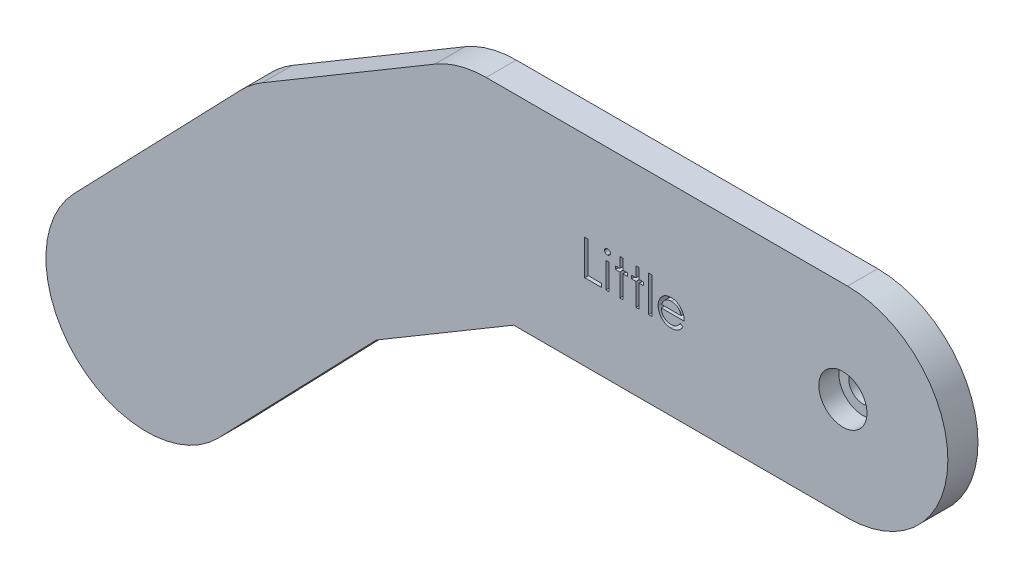
from build123d import *

# Parameters (mm, degrees)
BOSS_EXTRUDE1_DEPTH = 3
BOSS_EXTRUDE2_DEPTH = 3
BOSS_EXTRUDE4_DEPTH = 3
SKETCH4_R           = 1.4
CUT_EXTRUDE5_DEPTH  = 3
SKETCH5_R           = 2.4
CUT_EXTRUDE6_DEPTH  = 2
SKETCH6_W           = 0.314102564
SKETCH6_H           = 2.557692308
SKETCH6_W_2         = 0.314102565
SKETCH6_H_2         = 3.58974359
CUT_EXTRUDE7_DEPTH  = 1


with BuildPart() as part:
    # Sketch1 → Boss-Extrude1 (new body)
    with BuildSketch(Plane.XY):
        with BuildLine():
            Line((0, 10), (36, 10))
            ThreePointArc((36, 10), (46, 0), (36, -10))
            Line((36, -10), (0, -10))
            ThreePointArc((0, -10), (-10, 0), (0, 10))
        make_face()
    extrude(amount=BOSS_EXTRUDE1_DEPTH)

    # Sketch2 → Boss-Extrude2 (add)
    with BuildSketch(Plane.XY):
        with BuildLine():
            Line((5.104260767, -8.599216361), (-12.094171954, -18.807737895))
            ThreePointArc((-12.094171954, -18.807737895), (-25.797649082, -15.312782302), (-22.302693489, -1.609305174))
            Line((-22.302693489, -1.609305174), (-5.104260767, 8.599216361))
            ThreePointArc((-5.104260767, 8.599216361), (8.599216361, 5.104260767), (5.104260767, -8.599216361))
        make_face()
    extrude(amount=BOSS_EXTRUDE2_DEPTH)

    # Sketch3 → Boss-Extrude4 (add)
    with BuildSketch(Plane.XY):
        with BuildLine():
            Line((-9.998884105, -17.148730445), (-26.65538549, -34.427647124))
            ThreePointArc((-26.65538549, -34.427647124), (-40.795143017, -34.68698683), (-41.054482723, -20.547229303))
            Line((-41.054482723, -20.547229303), (-24.397981338, -3.268312624))
            ThreePointArc((-24.397981338, -3.268312624), (-10.258223811, -3.008972918), (-9.998884105, -17.148730445))
        make_face()
    extrude(amount=BOSS_EXTRUDE4_DEPTH)

    # Sketch4 → Cut-Extrude5 (cut)
    with BuildSketch(Plane.XY):
        with Locations((35.538598823, 0)):
            Circle(SKETCH4_R)
    extrude(amount=CUT_EXTRUDE5_DEPTH, mode=Mode.SUBTRACT)

    # Sketch5 → Cut-Extrude6 (cut)
    with BuildSketch(Plane.XY.offset(3)):
        with Locations((35.538598823, 0)):
            Circle(SKETCH5_R)
    extrude(amount=-CUT_EXTRUDE6_DEPTH, mode=Mode.SUBTRACT)

    # Sketch6 → Cut-Extrude7 (cut)
    # profile 1 of 7: a face of its own
    with BuildSketch(Plane.XY.offset(3)):
        Polygon((9.822398538, 1.128373328), (10.136501102, 1.128373328), (10.136501102, -2.012652313), (11.482654948, -2.012652313), (11.482654948, -2.371626672), (9.822398538, -2.371626672), align=None)
    # profile 2 of 7: a face of its own
    with BuildSketch(Plane.XY.offset(3)):
        with BuildLine():
            add(Edge.make_bspline(
                [(12.087021935, 1.262988713), (12.106513251, 1.26208456), (12.144680991, 1.260314056), (12.199874258, 1.245152579), (12.250131271, 1.219452894), (12.294709003, 1.184973213), (12.33296089, 1.144423769), (12.3597416, 1.097162801), (12.376953997, 1.046104162), (12.379032552, 1.010489073), (12.380090845, 0.9923557)],
                knots=[0, 0, 0, 0, 1.055194115, 2.066272739, 3.074728998, 4.095836921, 5.109056067, 6.073838105, 7.019297344, 8, 8, 8, 8], degree=3))
            add(Edge.make_bspline(
                [(12.380090845, 0.9923557), (12.379008686, 0.974693047), (12.376869384, 0.939776072), (12.359754895, 0.889602599), (12.332732658, 0.842998316), (12.294733532, 0.802527606), (12.250124771, 0.768066986), (12.199875985, 0.742362247), (12.144680537, 0.72720211), (12.106513097, 0.725431421), (12.087021935, 0.724527174)],
                knots=[0, 0, 0, 0, 0.96129708, 1.900370562, 2.859976407, 3.87933698, 4.906634145, 5.921202961, 6.938410037, 8, 8, 8, 8], degree=3))
            add(Edge.make_bspline(
                [(12.087021935, 0.724527174), (12.06775366, 0.725396894), (12.03025048, 0.727089691), (11.975883637, 0.742659709), (11.926055148, 0.768075782), (11.881390475, 0.802301967), (11.844160282, 0.843246864), (11.817061957, 0.889574158), (11.799986995, 0.939783313), (11.797842366, 0.974695479), (11.796757512, 0.9923557)],
                knots=[0, 0, 0, 0, 1.054934014, 2.053291228, 3.073705704, 4.106921865, 5.123545215, 6.088680038, 7.033164197, 8, 8, 8, 8], degree=3))
            add(Edge.make_bspline(
                [(11.796757512, 0.9923557), (11.797818599, 1.010486549), (11.79990264, 1.046096682), (11.817074756, 1.097191715), (11.843934564, 1.144173217), (11.881415127, 1.185198716), (11.926048587, 1.219444151), (11.975885333, 1.244855132), (12.030250032, 1.260426472), (12.067753508, 1.262119086), (12.087021935, 1.262988713)],
                knots=[0, 0, 0, 0, 0.98631895, 1.937192651, 2.907499808, 3.917963147, 4.944918757, 5.95915025, 6.951458133, 8, 8, 8, 8], degree=3))
        make_face()
    # profile 3 of 7: a face of its own
    with BuildSketch(Plane.XY.offset(3)):
        with Locations((12.088424179, -1.092780518)):
            Rectangle(SKETCH6_W, SKETCH6_H)
    # profile 4 of 7: a face of its own
    with BuildSketch(Plane.XY.offset(3)):
        Polygon((13.322398538, 1.218116918), (13.636501102, 1.218116918), (13.636501102, 0.186065636), (14.085219051, 0.186065636), (14.085219051, -0.128036928), (13.636501102, -0.128036928), (13.636501102, -2.371626672), (13.322398538, -2.371626672), (13.322398538, -0.128036928), (12.873680589, -0.128036928), (12.873680589, 0.186065636), (13.322398538, 0.186065636), align=None)
    # profile 5 of 7: a face of its own
    with BuildSketch(Plane.XY.offset(3)):
        Polygon((14.937783153, 1.218116918), (15.251885717, 1.218116918), (15.251885717, 0.186065636), (15.700603666, 0.186065636), (15.700603666, -0.128036928), (15.251885717, -0.128036928), (15.251885717, -2.371626672), (14.937783153, -2.371626672), (14.937783153, -0.128036928), (14.489065204, -0.128036928), (14.489065204, 0.186065636), (14.937783153, 0.186065636), align=None)
    # profile 6 of 7: a face of its own
    with BuildSketch(Plane.XY.offset(3)):
        with Locations((16.351244691, -0.576754877)):
            Rectangle(SKETCH6_W_2, SKETCH6_H_2)
    # profile 7 of 7: a face of its own
    with BuildSketch(Plane.XY.offset(3)):
        with BuildLine():
            Line((19.325403345, -1.563934364), (19.60444982, -1.71046882))
            add(Edge.make_bspline(
                [(19.60444982, -1.71046882), (19.582213225, -1.749912151), (19.538949616, -1.826653254), (19.464548868, -1.932085114), (19.386556796, -2.02693283), (19.301452828, -2.108662484), (19.211783149, -2.179913869), (19.117050494, -2.242251694), (19.016761676, -2.295370214), (18.910911951, -2.340122742), (18.7986124, -2.374532236), (18.679590884, -2.398836457), (18.553619388, -2.413859726), (18.467273209, -2.415604867), (18.423059595, -2.416498467)],
                knots=[0, 0, 0, 0, 1.120438281, 2.179929193, 3.190490725, 4.156257408, 5.095198341, 6.022838206, 6.959905092, 7.901321166, 8.864066838, 9.862729781, 10.905609505, 12, 12, 12, 12], degree=3))
            add(Edge.make_bspline(
                [(18.423059595, -2.416498467), (18.373917618, -2.415351292), (18.278055856, -2.413113485), (18.138516109, -2.39382102), (18.007136691, -2.362348662), (17.883924987, -2.31838312), (17.769182735, -2.260955796), (17.66268188, -2.190996314), (17.563862354, -2.10886406), (17.475838145, -2.013847616), (17.396594262, -1.912165659), (17.326668442, -1.806209774), (17.268211011, -1.69624655), (17.220658401, -1.582976026), (17.182253536, -1.467112132), (17.155486832, -1.347600665), (17.140057084, -1.224765081), (17.137692639, -1.141667745), (17.136501102, -1.099791736)],
                knots=[0, 0, 0, 0, 1.145258523, 2.234067595, 3.276747158, 4.290159414, 5.277019952, 6.260822364, 7.254936242, 8.264827045, 9.274100331, 10.257902744, 11.220704747, 12.172965371, 13.118907548, 14.062713208, 15.023725156, 16, 16, 16, 16], degree=3))
            add(Edge.make_bspline(
                [(17.136501102, -1.099791736), (17.137560243, -1.060496906), (17.139659321, -0.982619741), (17.152890109, -0.867354197), (17.176338402, -0.755325744), (17.208514726, -0.646441296), (17.250065972, -0.540883162), (17.300898191, -0.438587098), (17.361090569, -0.339661959), (17.407563243, -0.277258825), (17.430972256, -0.24582539)],
                knots=[0, 0, 0, 0, 1.024358464, 2.0301432, 3.019427413, 4.004406732, 4.986367066, 5.972626655, 6.978780325, 8, 8, 8, 8], degree=3))
            add(Edge.make_bspline(
                [(17.430972256, -0.24582539), (17.462679938, -0.20795652), (17.525090885, -0.133418369), (17.63064724, -0.035480044), (17.744947437, 0.046563731), (17.866559063, 0.114570868), (17.996895537, 0.166244515), (18.134204828, 0.204752097), (18.280050414, 0.226330108), (18.379755635, 0.229377941), (18.430771935, 0.23093743)],
                knots=[0, 0, 0, 0, 1.030682036, 2.02871468, 2.997146059, 3.962720338, 4.930598197, 5.918074684, 6.934738563, 8, 8, 8, 8], degree=3))
            add(Edge.make_bspline(
                [(18.430771935, 0.23093743), (18.48321954, 0.229583382), (18.586109786, 0.226927046), (18.736141907, 0.202300713), (18.878102624, 0.163248158), (19.011935128, 0.108094368), (19.137652989, 0.036934816), (19.254439039, -0.051207025), (19.364290551, -0.153625113), (19.42819913, -0.232388322), (19.460719852, -0.272468018)],
                knots=[0, 0, 0, 0, 1.056321875, 2.072262726, 3.055038591, 4.01806755, 4.982017516, 5.957941055, 6.960871419, 8, 8, 8, 8], degree=3))
            add(Edge.make_bspline(
                [(19.460719852, -0.272468018), (19.48284679, -0.3026716), (19.526953383, -0.362877718), (19.582200483, -0.461048875), (19.630157878, -0.56375947), (19.668490839, -0.672669767), (19.69953034, -0.786489347), (19.721987159, -0.906031892), (19.735156778, -1.031261803), (19.737745475, -1.116588359), (19.739065204, -1.160088211)],
                knots=[0, 0, 0, 0, 0.94817472, 1.890038105, 2.849395472, 3.817997239, 4.812318967, 5.836947057, 6.897266129, 8, 8, 8, 8], degree=3))
            Line((19.739065204, -1.160088211), (17.450603666, -1.160088211))
            add(Edge.make_bspline(
                [(17.450603666, -1.160088211), (17.452143272, -1.193788675), (17.455170846, -1.260059279), (17.469285989, -1.357030062), (17.491534763, -1.449403404), (17.522803826, -1.536486446), (17.560670671, -1.619416573), (17.607056388, -1.69757861), (17.662395942, -1.77061654), (17.724121641, -1.839183678), (17.792828737, -1.900244439), (17.865111484, -1.954896215), (17.942005049, -2.000701812), (18.022903132, -2.037881702), (18.107674917, -2.066988018), (18.196347113, -2.086855839), (18.288745229, -2.100162945), (18.351730963, -2.101642611), (18.383796775, -2.102395903)],
                knots=[0, 0, 0, 0, 1.094153842, 2.151609401, 3.174256925, 4.172055639, 5.149267565, 6.128595816, 7.11444997, 8.118368179, 9.117203808, 10.09244225, 11.054858984, 12.015122123, 12.976791628, 13.957293641, 14.960065497, 16, 16, 16, 16], degree=3))
            add(Edge.make_bspline(
                [(18.383796775, -2.102395903), (18.415147922, -2.101787846), (18.477354613, -2.100581345), (18.569995471, -2.088849434), (18.661134998, -2.069879159), (18.750395981, -2.043989169), (18.835966827, -2.012412316), (18.915212377, -1.974309459), (18.988092593, -1.932159712), (19.05620956, -1.883950037), (19.122280553, -1.82494185), (19.187823039, -1.751306129), (19.258099693, -1.664218601), (19.302089285, -1.598672935), (19.325403345, -1.563934364)],
                knots=[0, 0, 0, 0, 0.99110716, 1.966546729, 2.947904876, 3.932708344, 4.903319531, 5.828989031, 6.710028674, 7.56322171, 8.463672341, 9.504779593, 10.677557249, 12, 12, 12, 12], degree=3))
        make_face()
        with BuildLine():
            add(Edge.make_bspline(
                [(19.42496264, -0.845985646), (19.413466016, -0.804322773), (19.391338714, -0.724135152), (19.34510235, -0.613094262), (19.293030809, -0.514406361), (19.231409078, -0.428826728), (19.161590352, -0.352823215), (19.080945169, -0.286404629), (18.990509276, -0.226987178), (18.890750135, -0.176834679), (18.78510835, -0.13414482), (18.674502158, -0.105519704), (18.56164437, -0.085910162), (18.485310084, -0.084084054), (18.446897736, -0.083165134)],
                knots=[0, 0, 0, 0, 1.154881502, 2.222775134, 3.210006277, 4.132804581, 5.035138423, 5.962687519, 6.919655026, 7.923214229, 8.944639381, 9.960483929, 10.97369054, 12, 12, 12, 12], degree=3))
            add(Edge.make_bspline(
                [(18.446897736, -0.083165134), (18.415548298, -0.083776805), (18.353577049, -0.084985951), (18.262275981, -0.096456081), (18.174596282, -0.115415925), (18.089890994, -0.141380882), (18.009270126, -0.175989485), (17.931075358, -0.216572711), (17.857294961, -0.266114295), (17.811153666, -0.30387315), (17.787843249, -0.322948787)],
                knots=[0, 0, 0, 0, 1.04873581, 2.073130211, 3.073294108, 4.04793562, 5.032784715, 6.005352987, 6.992311501, 8, 8, 8, 8], degree=3))
            add(Edge.make_bspline(
                [(17.787843249, -0.322948787), (17.771149967, -0.338043103), (17.737366833, -0.368590319), (17.692226312, -0.421219526), (17.649005839, -0.477971088), (17.609672186, -0.541016212), (17.5735946, -0.609636991), (17.539834622, -0.683254627), (17.50944821, -0.762427757), (17.4923521, -0.817600196), (17.48355639, -0.845985646)],
                knots=[0, 0, 0, 0, 0.879870761, 1.780643979, 2.707998968, 3.669668524, 4.684282772, 5.740141944, 6.837334558, 8, 8, 8, 8], degree=3))
            Line((17.48355639, -0.845985646), (19.42496264, -0.845985646))
        make_face(mode=Mode.SUBTRACT)
    extrude(amount=-CUT_EXTRUDE7_DEPTH, mode=Mode.SUBTRACT)


solid = part.part
